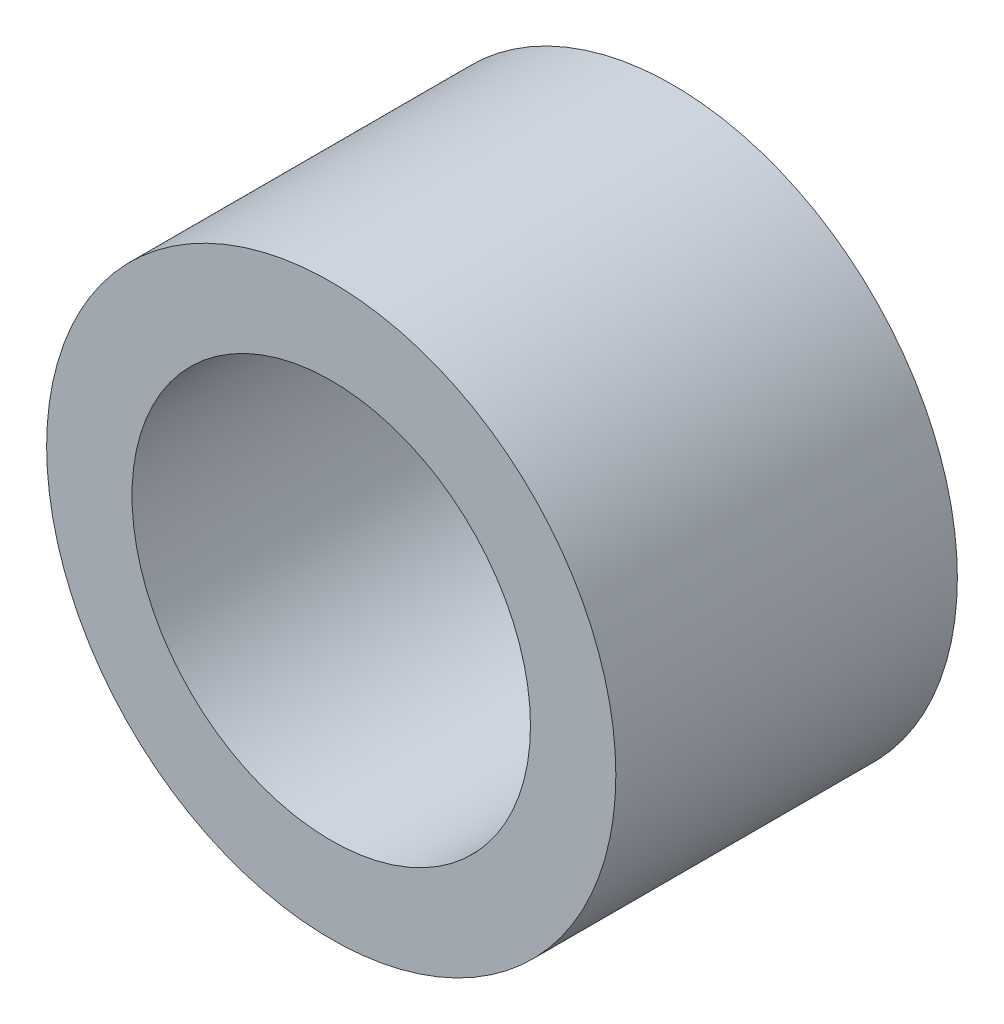
from build123d import *

# Parameters (mm, degrees)
SKETCH_1_R      = 30
SKETCH_1_R_2    = 21
EXTRUDE_1_DEPTH = 18


with BuildPart() as part:
    # 草图1 → 凸台-拉伸1 (new, symmetric)
    with BuildSketch(Plane.XY):
        Circle(SKETCH_1_R)
        Circle(SKETCH_1_R_2, mode=Mode.SUBTRACT)
    extrude(amount=EXTRUDE_1_DEPTH, both=True)


solid = part.part
